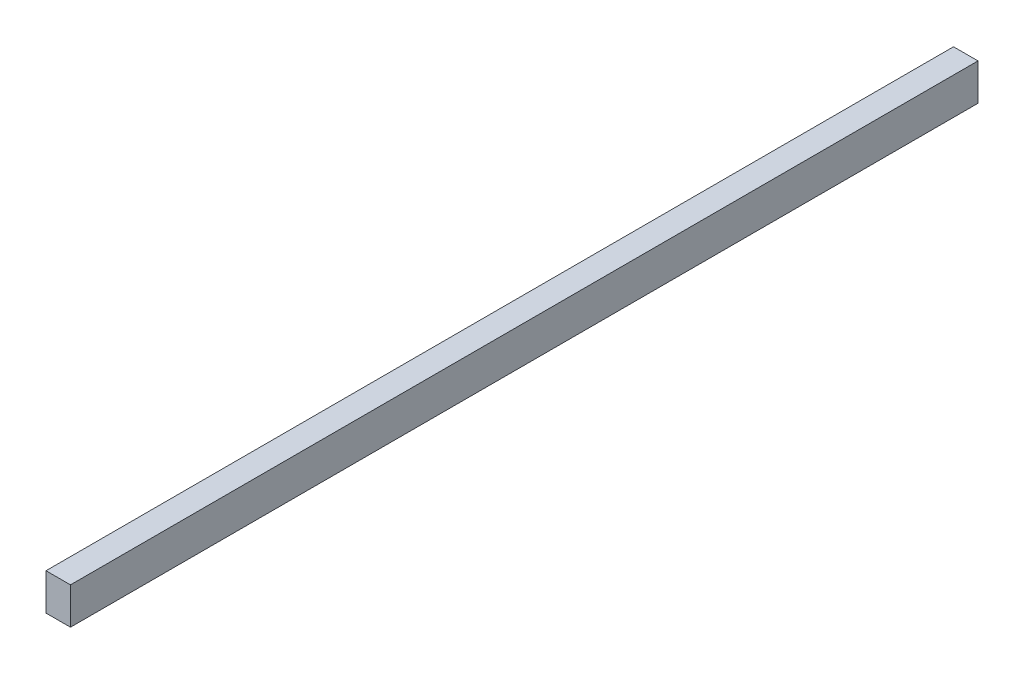
from build123d import *

# Parameters (mm, degrees)
SKETCH1_W           = 445
SKETCH1_H           = 18
BOSS_EXTRUDE1_DEPTH = 12


with BuildPart() as part:
    # Sketch1 → Boss-Extrude1 (new body)
    with BuildSketch(Plane(origin=(0, 0, 0), x_dir=(0, 0, -1), z_dir=(1, 0, 0))):
        with Locations((222.5, 9)):
            Rectangle(SKETCH1_W, SKETCH1_H)
    extrude(amount=BOSS_EXTRUDE1_DEPTH)


solid = part.part
